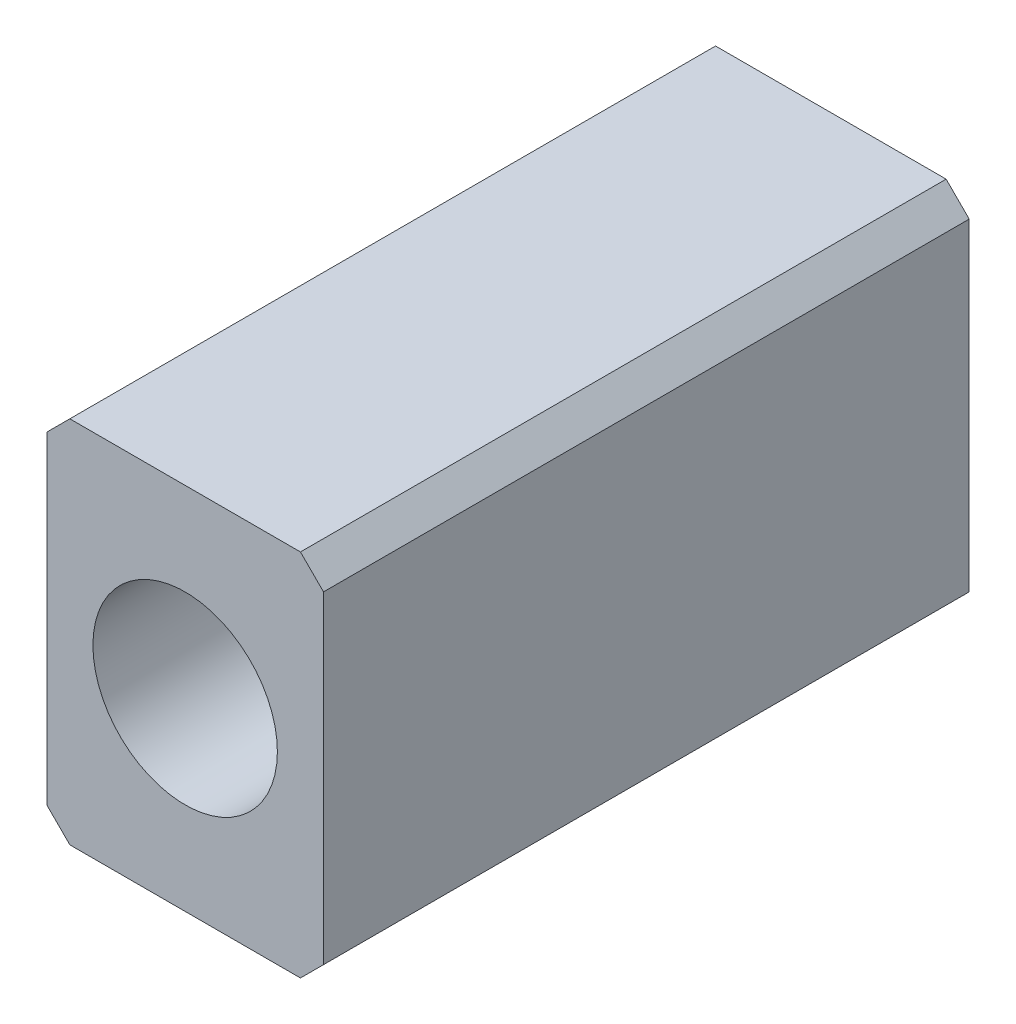
from build123d import *

# Parameters (mm, degrees)
ESQUISSE1_W           = 12
ESQUISSE1_H           = 16
ESQUISSE1_R           = 4
BOSS_EXTRU_1_DEPTH    = 14
CHANFREIN1_SIZE       = 1
TROU_TARAUD_M31_D     = 2.5
TROU_TARAUD_M31_DEPTH = 8.5
TROU_TARAUD_M31_TIP   = 0.751075774


with BuildPart() as part:
    # Esquisse1 → Boss.-Extru.1 (new, symmetric)
    with BuildSketch(Plane.XY):
        Rectangle(ESQUISSE1_W, ESQUISSE1_H)
        Circle(ESQUISSE1_R, mode=Mode.SUBTRACT)
    extrude(amount=BOSS_EXTRU_1_DEPTH, both=True)

    # Chanfrein1
    chanfrein1_edges = [part.edges().sort_by_distance(p)[0] for p in [
        (-6, 8, 0),
        (6, 8, 0),
        (6, -8, 0),
        (-6, -8, 0),
    ]]
    chamfer(chanfrein1_edges, length=CHANFREIN1_SIZE)

    # Trou taraudé M31
    with Locations(Plane(origin=(0, -8, 0), x_dir=(-1, 0, 0), z_dir=(0, -1, 0))):
        with Locations((0, 8), (0, -8)):
            Hole(TROU_TARAUD_M31_D / 2, depth=TROU_TARAUD_M31_DEPTH)
            with Locations((0, 0, -(TROU_TARAUD_M31_DEPTH + TROU_TARAUD_M31_TIP / 2))):  # 118° drill point
                Cone(0, TROU_TARAUD_M31_D / 2, TROU_TARAUD_M31_TIP, mode=Mode.SUBTRACT)


solid = part.part
